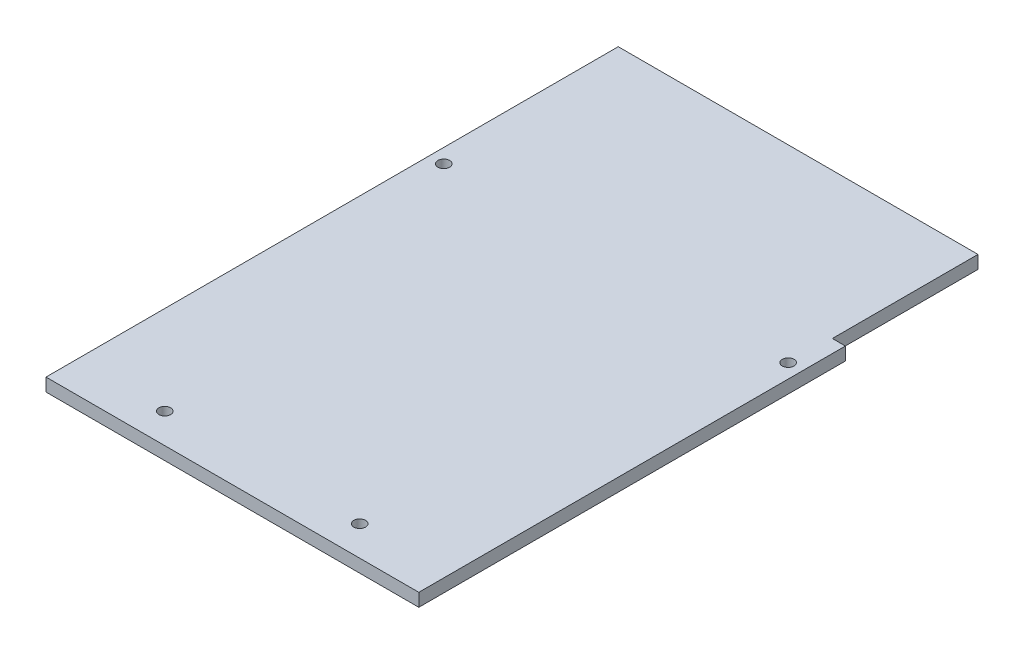
from build123d import *

# Parameters (mm, degrees)
SKETCH1_W             = 136.525
SKETCH1_H             = 209.55
BOSS_EXTRUDE1_DEPTH   = 4.7625
SKETCH2_W             = 4.7752
SKETCH2_H             = 53.34
CUT_EXTRUDE1_DEPTH    = 170.873266436
F_8_CLEARANCE_HOLE1_D = 4.3053


with BuildPart() as part:
    # Sketch1 → Boss-Extrude1 (new body)
    with BuildSketch(Plane(origin=(0, 0, 0), x_dir=(1, 0, 0), z_dir=(0, 1, 0))):
        with Locations((45.474550145, 21.312781595)):
            Rectangle(SKETCH1_W, SKETCH1_H)
    extrude(amount=BOSS_EXTRUDE1_DEPTH)

    # Sketch2 → Cut-Extrude1 (cut, through all)
    with BuildSketch(Plane(origin=(0, 4.7625, 0), x_dir=(1, 0, 0), z_dir=(0, 1, 0))):
        with Locations((111.349450145, 99.417781595)):
            Rectangle(SKETCH2_W, SKETCH2_H)
    extrude(amount=-CUT_EXTRUDE1_DEPTH, mode=Mode.SUBTRACT)

    # #8 Clearance Hole1 (through all)
    with Locations(Plane(origin=(0, 4.7625, 0), x_dir=(1, 0, 0), z_dir=(0, 1, 0))):
        with Locations((81.161550145, -72.540218405), (9.787550145, -72.540218405), (-17.580949855, 56.999781595), (108.530050145, 56.999781595)):
            Hole(F_8_CLEARANCE_HOLE1_D / 2)


solid = part.part
